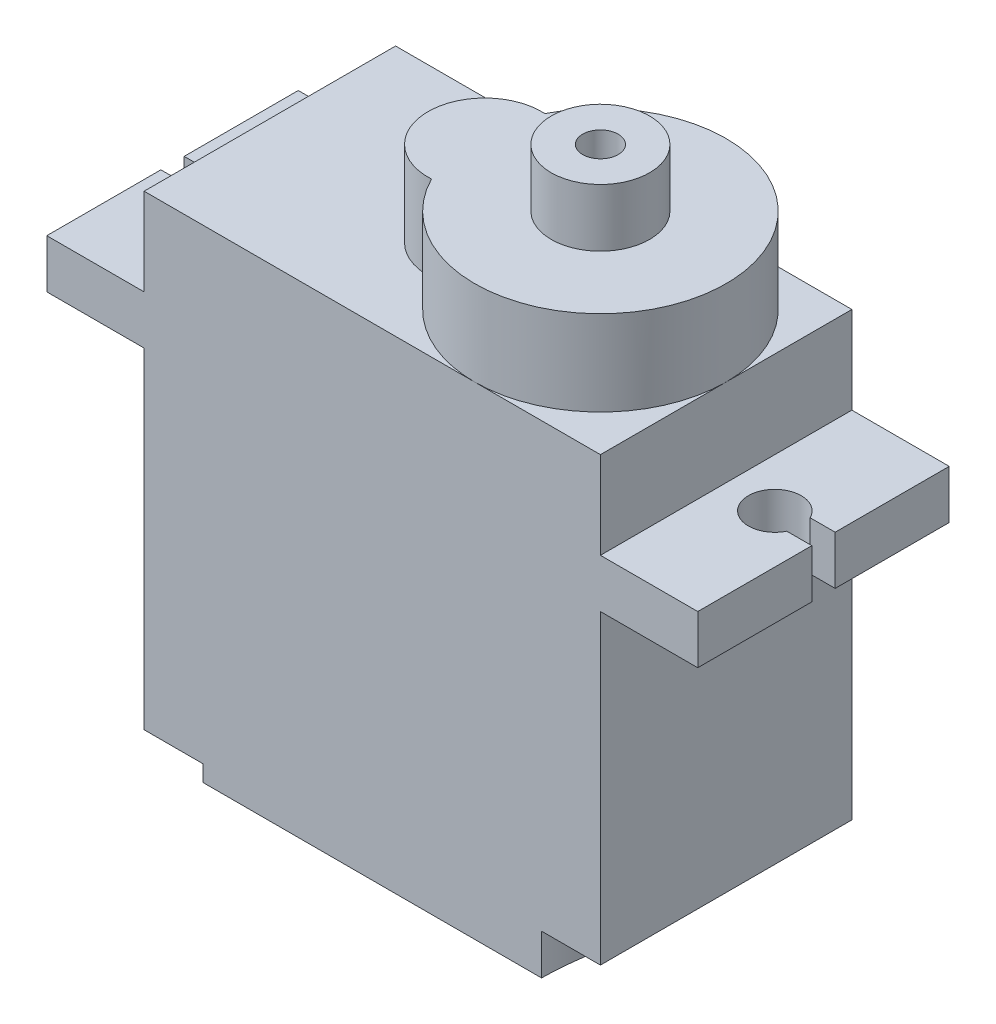
from build123d import *

# Parameters (mm, degrees)
CROQUIS1_W              = 4.8
CROQUIS1_H              = 2.4
CROQUIS1_W_2            = 22.5
CROQUIS1_H_2            = 23.8
SALIENTE_EXTRUIR1_DEPTH = 6.2
SALIENTE_EXTRUIR2_DEPTH = 4.2
CORTAR_EXTRUIR1_REACH   = 28.006
CORTAR_EXTRUIR3_DEPTH   = 0.8
CROQUIS4_5_W            = 1.5
CROQUIS4_5_H            = 3.75
CORTAR_EXTRUIR4_DEPTH   = 2
CORTAR_EXTRUIR5_DEPTH   = 26.895414652
CROQUIS7_R              = 2.425
CROQUIS7_R_2            = 0.875
SALIENTE_EXTRUIR4_DEPTH = 2.85


with BuildPart() as part:
    # Croquis1 → Saliente-Extruir1 (new, symmetric)
    with BuildSketch(Plane.XY):
        with Locations((-13.65, 6.4)):
            Rectangle(CROQUIS1_W, CROQUIS1_H)
        Rectangle(CROQUIS1_W_2, CROQUIS1_H_2)
        with Locations((13.65, 6.4)):
            Rectangle(CROQUIS1_W, CROQUIS1_H)
    extrude(amount=SALIENTE_EXTRUIR1_DEPTH, both=True)

    # Croquis2 → Saliente-Extruir2 (add)
    with BuildSketch(Plane(origin=(0, 11.9, 0), x_dir=(1, 0, 0), z_dir=(0, 1, 0))):
        with BuildLine():
            ThreePointArc((-0.484210526, -2.79508745), (11.25, 0), (-0.484210526, 2.79508745))
            ThreePointArc((-0.484210526, 2.79508745), (-3.45, 0), (-0.484210526, -2.79508745))
        make_face()
    extrude(amount=SALIENTE_EXTRUIR2_DEPTH)

    # Croquis3 → Cortar-Extruir1 (cut, up to next)
    with BuildSketch(Plane(origin=(0, 7.6, 0), x_dir=(1, 0, 0), z_dir=(0, 1, 0)), mode=Mode.PRIVATE) as cortar_extruir1_sk1:
        with BuildLine():
            Line((16.05, 0.575), (14.815922382, 0.575))
            ThreePointArc((14.815922382, 0.575), (12.35, 0), (14.815922382, -0.575))
            Line((14.815922382, -0.575), (16.05, -0.575))
            Line((16.05, -0.575), (16.05, 0.575))
        make_face()
    cortar_extruir1_tool1 = extrude(cortar_extruir1_sk1.sketch, amount=-CORTAR_EXTRUIR1_REACH, mode=Mode.PRIVATE) & part.part
    # Croquis3 → Cortar-Extruir1 (cut, up to next)
    with BuildSketch(Plane(origin=(0, 7.6, 0), x_dir=(1, 0, 0), z_dir=(0, 1, 0)), mode=Mode.PRIVATE) as cortar_extruir1_sk2:
        with BuildLine():
            Line((-16.05, 0.575), (-14.815922382, 0.575))
            ThreePointArc((-14.815922382, 0.575), (-12.35, 0), (-14.815922382, -0.575))
            Line((-14.815922382, -0.575), (-16.05, -0.575))
            Line((-16.05, -0.575), (-16.05, 0.575))
        make_face()
    cortar_extruir1_tool2 = extrude(cortar_extruir1_sk2.sketch, amount=-CORTAR_EXTRUIR1_REACH, mode=Mode.PRIVATE) & part.part
    add(cortar_extruir1_tool1.solids().sort_by_distance((14.012834, 7.6, 0))[0], mode=Mode.SUBTRACT)
    add(cortar_extruir1_tool2.solids().sort_by_distance((-14.012834, 7.6, 0))[0], mode=Mode.SUBTRACT)

    # Croquis4 → Cortar-Extruir3 (cut)
    with BuildSketch(Plane.XZ.offset(11.9)):
        with BuildLine():
            Line((-11.25, 6.2), (-11.25, 3.3))
            ThreePointArc((-11.25, 3.3), (-9.199390335, 4.149390335), (-8.35, 6.2))
            Line((-8.35, 6.2), (-11.25, 6.2))
        make_face()
        with BuildLine():
            ThreePointArc((-8.35, -6.2), (-9.199390335, -4.149390335), (-11.25, -3.3))
            Line((-11.25, -3.3), (-11.25, -6.2))
            Line((-11.25, -6.2), (-8.35, -6.2))
        make_face()
    extrude(amount=-CORTAR_EXTRUIR3_DEPTH, mode=Mode.SUBTRACT)

    # Croquis4<5> → Cortar-Extruir4 (cut)
    with BuildSketch(Plane.XZ.offset(11.9)):
        with BuildLine():
            Line((11.25, 6.2), (8.35, 6.2))
            ThreePointArc((8.35, 6.2), (9.199390335, 4.149390335), (11.25, 3.3))
            Line((11.25, 3.3), (11.25, 6.2))
        make_face()
        with BuildLine():
            ThreePointArc((11.25, -3.3), (9.199390335, -4.149390335), (8.35, -6.2))
            Line((8.35, -6.2), (11.25, -6.2))
            Line((11.25, -6.2), (11.25, -3.3))
        make_face()
        with Locations((10.5, 0)):
            Rectangle(CROQUIS4_5_W, CROQUIS4_5_H)
    extrude(amount=-CORTAR_EXTRUIR4_DEPTH, mode=Mode.SUBTRACT)

    # Croquis6 → Cortar-Extruir5 (cut, through all)
    with BuildSketch(Plane(origin=(0, 0, -6.2), x_dir=(-1, 0, 0), z_dir=(0, 0, -1))):
        Polygon((-11.25, -9.9), (-8.35, -11.9), (-11.25, -11.9), align=None)
    extrude(amount=-CORTAR_EXTRUIR5_DEPTH, mode=Mode.SUBTRACT)

    # Croquis7 → Saliente-Extruir4 (add)
    with BuildSketch(Plane(origin=(0, 16.1, 0), x_dir=(1, 0, 0), z_dir=(0, 1, 0))):
        with Locations(Location((5.05, 0, 0), (0, 0, 270))):
            Circle(CROQUIS7_R)
        with Locations(Location((5.05, 0, 0), (0, 0, 270))):
            Circle(CROQUIS7_R_2, mode=Mode.SUBTRACT)
    extrude(amount=SALIENTE_EXTRUIR4_DEPTH)


solid = part.part
